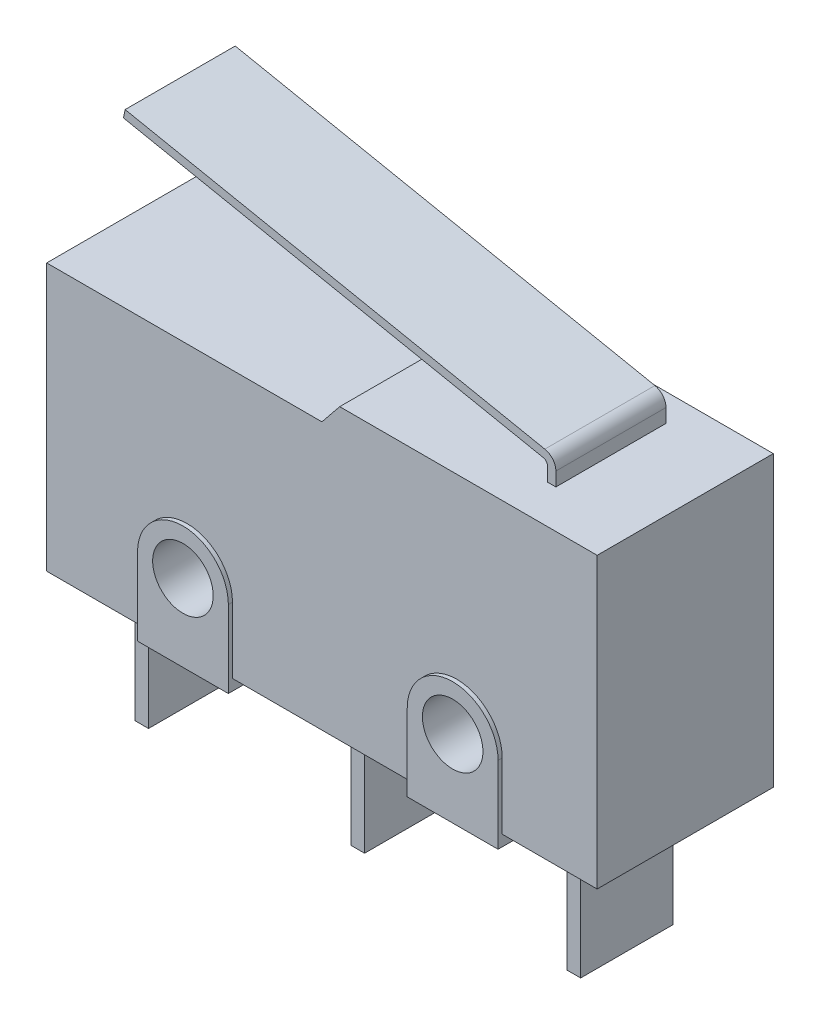
from build123d import *

# Parameters (mm, degrees)
BOSS_EXTRUDE1_DEPTH = 6.4
SKETCH3_R           = 1.1
CUT_EXTRUDE1_DEPTH  = 14.148478999
BOSS_EXTRUDE2_START = 0.15
SKETCH4_R           = 1.1
BOSS_EXTRUDE2_DEPTH = 6.7
SKETCH5_W           = 0.5
SKETCH5_H           = 3.35
BOSS_EXTRUDE3_DEPTH = 4.4
SKETCH6_W           = 0.5
SKETCH6_H           = 3.35
BOSS_EXTRUDE4_DEPTH = 4.4
EXTRUDE_THIN2_START = -1
EXTRUDE_THIN2_DEPTH = 4


with BuildPart() as part:
    # Sketch1 → Boss-Extrude1 (new body)
    with BuildSketch(Plane.XY):
        Polygon((-10, 4.85), (0, 4.85), (0.64599961, 5.65), (10, 5.65), (10, 4.85), (10, -4.85), (-10, -4.85), align=None)
    extrude(amount=BOSS_EXTRUDE1_DEPTH)

    # Sketch3 → Cut-Extrude1 (cut, through all)
    with BuildSketch(Plane.XY.offset(6.4)):
        with Locations((-4.9, -2.45)):
            Circle(SKETCH3_R)
    cut_extrude1 = extrude(amount=-CUT_EXTRUDE1_DEPTH, mode=Mode.SUBTRACT)

    # Sketch4 → Boss-Extrude2 (add)
    with BuildSketch(Plane.XY.offset(6.4).offset(BOSS_EXTRUDE2_START)):
        with BuildLine():
            Line((-6.55, -2.45), (-6.55, -5.25))
            Line((-6.55, -5.25), (-3.25, -5.25))
            Line((-3.25, -5.25), (-3.25, -2.45))
            ThreePointArc((-3.25, -2.45), (-4.9, -0.8), (-6.55, -2.45))
        make_face()
        with Locations((-4.9, -2.45)):
            Circle(SKETCH4_R, mode=Mode.SUBTRACT)
    boss_extrude2 = extrude(amount=-BOSS_EXTRUDE2_DEPTH)

    # Sketch5 → Boss-Extrude3 (add)
    with BuildSketch(Plane.XZ.offset(4.85)):
        with Locations((-7.85, 3.425)):
            Rectangle(SKETCH5_W, SKETCH5_H)
    boss_extrude3 = extrude(amount=BOSS_EXTRUDE3_DEPTH)

    # Sketch6 → Boss-Extrude4 (add)
    with BuildSketch(Plane(origin=(0, -4.85, -4.85), x_dir=(-1, 0, 0), z_dir=(0, 1, 0))):
        with Locations((0, 8.275)):
            Rectangle(SKETCH6_W, SKETCH6_H)
    extrude(amount=-BOSS_EXTRUDE4_DEPTH)

    # Mirror1: Cut-Extrude1, Boss-Extrude2, Boss-Extrude3 across plane
    add(cut_extrude1.mirror(Plane(origin=(0, 0, 0), x_dir=(0, 0, 1), z_dir=(1, 0, 0))), mode=Mode.SUBTRACT)
    add(boss_extrude2.mirror(Plane(origin=(0, 0, 0), x_dir=(0, 0, 1), z_dir=(1, 0, 0))))
    add(boss_extrude3.mirror(Plane(origin=(0, 0, 0), x_dir=(0, 0, 1), z_dir=(1, 0, 0))))

    # Sketch7 → Extrude-Thin2 (add)
    with BuildSketch(Plane(origin=(0, 0, 0), x_dir=(-1, 0, 0), z_dir=(0, 0, -1)).offset(EXTRUDE_THIN2_START)):
        with BuildLine():
            Line((-7.1, 5.65), (-7.1, 6.15))
            ThreePointArc((-7.1, 6.15), (-6.986771965, 6.466871341), (-6.698370212, 6.640227806))
            Line((-6.698370212, 6.640227806), (8.55, 9.7))
            Line((8.55, 9.7), (8.609022127, 9.405863317))
            Line((8.609022127, 9.405863317), (-6.639348085, 6.346091122))
            ThreePointArc((-6.639348085, 6.346091122), (-6.754708786, 6.276748537), (-6.8, 6.15))
            Line((-6.8, 6.15), (-6.8, 5.65))
            Line((-6.8, 5.65), (-7.1, 5.65))
        make_face()
    extrude(amount=-EXTRUDE_THIN2_DEPTH)


solid = part.part
